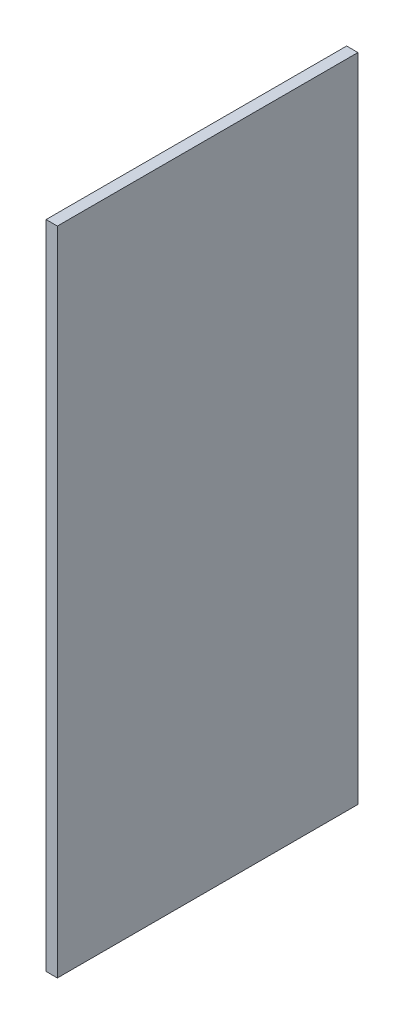
from build123d import *

# Parameters (mm, degrees)
OVEN_YALITIM_TASYUNU_SAG_1_START = -20
SKETCH1_W                        = 30
SKETCH1_H                        = 1730
OVEN_YALITIM_TASYUNU_SAG_1_DEPTH = 798.5


with BuildPart() as part:
    # Sketch1 → OVEN_yalitim_tasyunu_sag_1 (new body)
    with BuildSketch(Plane.XY.offset(OVEN_YALITIM_TASYUNU_SAG_1_START)):
        with Locations((683.5, 985)):
            Rectangle(SKETCH1_W, SKETCH1_H)
    extrude(amount=-OVEN_YALITIM_TASYUNU_SAG_1_DEPTH)


solid = part.part
